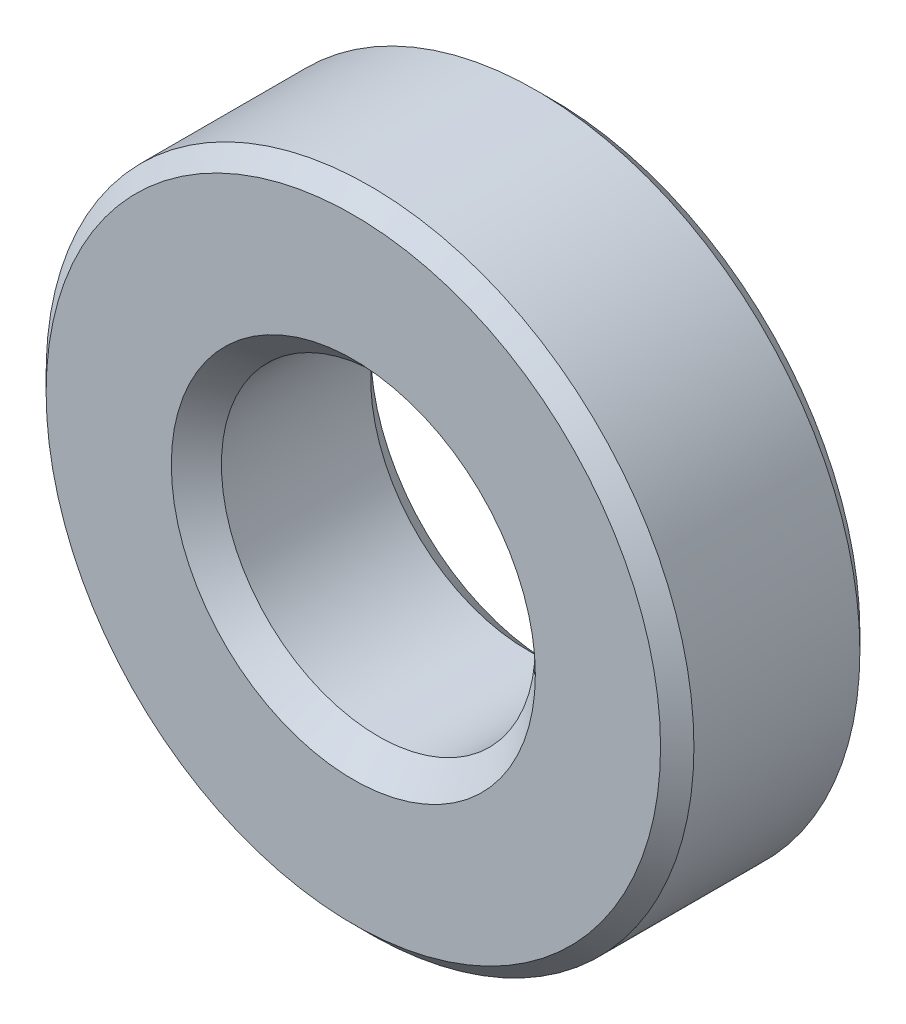
from build123d import *

# Parameters (mm, degrees)
BOSS_EXTRUDE1_DEPTH      = 2
BOSS_EXTRUDE1_DEPTH_BACK = 2
SKETCH3_R                = 6.5
SKETCH3_R_2              = 3.15
CHAMFER1_SIZE            = 0.335
CHAMFER2_SIZE            = 0.5025


with BuildPart() as part:
    # Sketch3 → Boss-Extrude1 (new, two sides: drawn at the far end of the back side and taken through both)
    with BuildSketch(Plane.XY.offset(-BOSS_EXTRUDE1_DEPTH_BACK)):
        Circle(SKETCH3_R)
        Circle(SKETCH3_R_2, mode=Mode.SUBTRACT)
    extrude(amount=BOSS_EXTRUDE1_DEPTH + BOSS_EXTRUDE1_DEPTH_BACK)

    # Chamfer1
    chamfer1_edges = [part.edges().sort_by_distance(p)[0] for p in [
        (-6.5, 0, -2),
        (-6.5, 0, 2),
    ]]
    chamfer(chamfer1_edges, length=CHAMFER1_SIZE)

    # Chamfer2
    chamfer2_edges = [part.edges().sort_by_distance(p)[0] for p in [
        (-3.15, 0, -2),
        (-3.15, 0, 2),
    ]]
    chamfer(chamfer2_edges, length=CHAMFER2_SIZE)


solid = part.part
